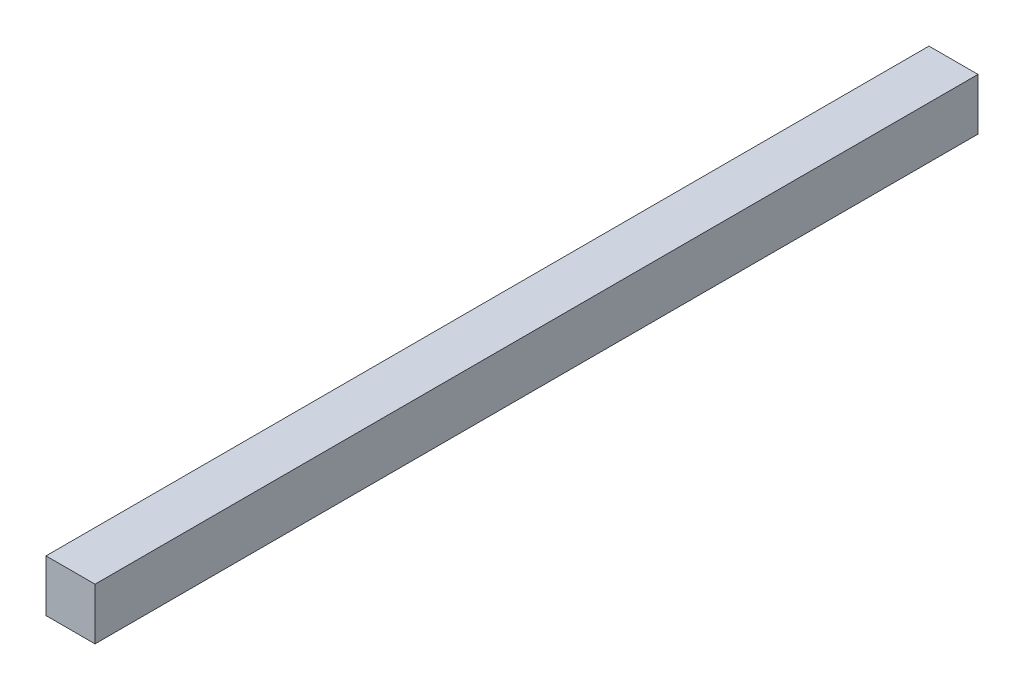
from build123d import *

# Parameters (mm, degrees)
EXTRUDE_2_DEPTH      = 100
EXTRUDE_2_DEPTH_BACK = 74.1
SKETCH_1_W           = 9.665369
SKETCH_1_H           = 10.19989157


with BuildPart() as part:
    # 草图1 → 凸台-拉伸2 (new, two sides: drawn at the far end of the back side and taken through both)
    with BuildSketch(Plane.XY.offset(-EXTRUDE_2_DEPTH_BACK)):
        Rectangle(SKETCH_1_W, SKETCH_1_H)
    extrude(amount=EXTRUDE_2_DEPTH + EXTRUDE_2_DEPTH_BACK)


solid = part.part
